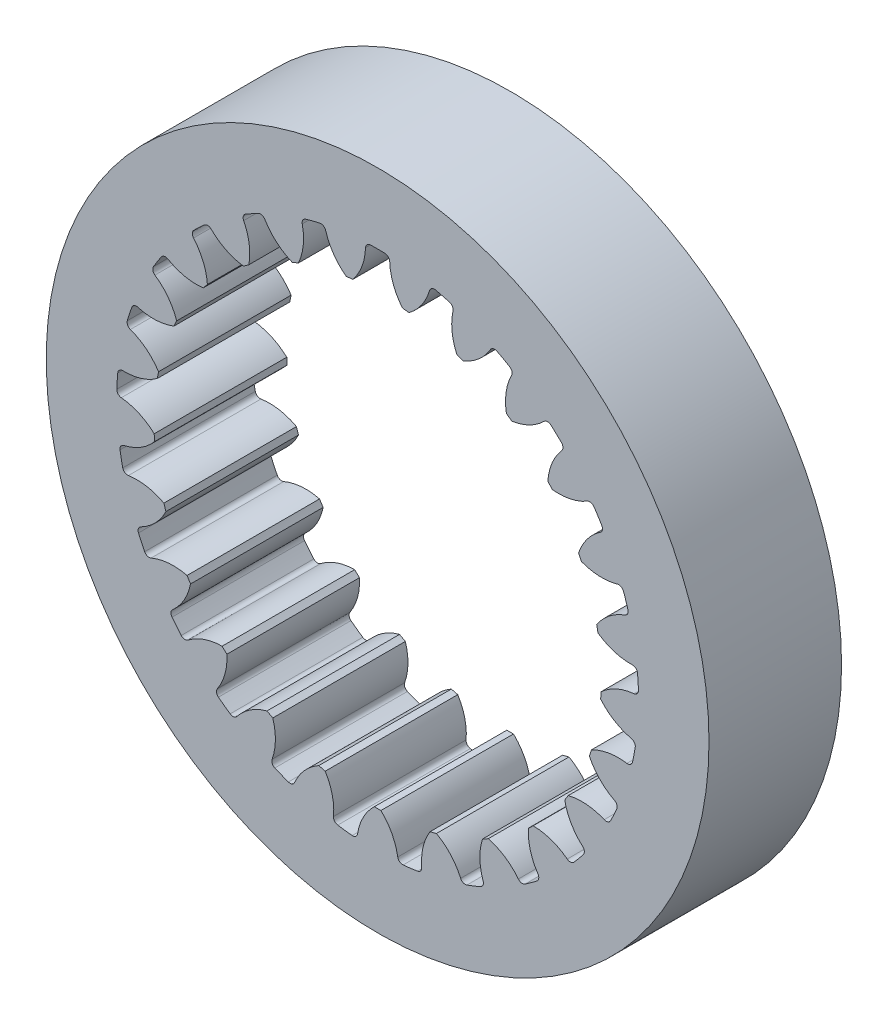
from build123d import *

# Parameters (mm, degrees)
SKETCH_1_R                       = 25
EXTRUDE_1_DEPTH                  = 10
CUT_EXTRUDE_2_DEPTH              = 37.742346142
FILLET_1_R                       = 0.375
PATTERN_CIRCULAR_1_COUNT         = 25
FILLET_1_OF_PATTERN_CIRCULAR_1_R = 0.375


with BuildPart() as part:
    # Эскиз1 → Бобышка-Вытянуть1 (new body)
    with BuildSketch(Plane.XY):
        Circle(SKETCH_1_R)
    extrude(amount=EXTRUDE_1_DEPTH)

    # Эскиз2 → Вырез-Вытянуть2 (cut, symmetric)
    with BuildSketch(Plane.XY):
        with BuildLine():
            ThreePointArc((1.867238125, 16.771375817), (1.124083924, 18.131023222), (0.914364942, 19.666255185))
            ThreePointArc((0.914364942, 19.666255185), (0, 19.6875), (-0.914364942, 19.666255185))
            ThreePointArc((-0.914364942, 19.666255185), (-1.124083924, 18.131023222), (-1.867238125, 16.771375817))
            ThreePointArc((-1.867238125, 16.771375817), (0, -16.875), (1.867238125, 16.771375817))
        make_face()
    cut_extrude_2 = extrude(amount=CUT_EXTRUDE_2_DEPTH, both=True, mode=Mode.SUBTRACT)

    # Скругление1
    fillet_1_edges = [part.edges().sort_by_distance(p)[0] for p in [
        (-0.914364942, 19.666255185, 5),
        (0.914364942, 19.666255185, 5),
    ]]
    fillet(fillet_1_edges, radius=FILLET_1_R)

    # Круговой массив1: Вырез-Вытянуть2 ×25 about axis
    pattern_circular_1_axis = Axis((0, 0, 0), (0, 0, 1))
    for i in range(1, PATTERN_CIRCULAR_1_COUNT):
        add(cut_extrude_2.rotate(pattern_circular_1_axis, i * 360 / PATTERN_CIRCULAR_1_COUNT), mode=Mode.SUBTRACT)

    # Скругление1 of Круговой массив1
    fillet_1_of_pattern_circular_1_edges = [part.edges().sort_by_distance(p)[0] for p in [
        (-5.776437269, 18.8210103, 5),
        (-4.005160297, 19.275796929, 5),
        (-10.275554798, 16.79317212, 5),
        (-8.673026584, 17.674169461, 5),
        (-14.129021428, 13.710157174, 5),
        (-12.795934714, 14.962008924, 5),
        (-17.094709679, 9.76568263, 5),
        (-16.114827206, 11.30973034, 5),
        (-18.986274451, 5.207594331, 5),
        (-18.421165839, 6.946819805, 5),
        (-19.684861773, 0.322293728, 5),
        (-19.570034873, 2.147415032, 5),
        (-19.146576833, -4.583257775, 5),
        (-19.489246643, -2.786919724, 5),
        (-17.405242055, -9.200826336, 5),
        (-18.18387737, -7.546142065, 5),
        (-14.570271906, -13.24027314, 5),
        (-15.735948206, -11.831212547, 5),
        (-10.819797988, -16.447784889, 5),
        (-12.299271543, -15.372884432, 5),
        (-6.38947637, -18.621821822, 5),
        (-8.089786416, -17.948621451, 5),
        (-1.557680453, -19.625781204, 5),
        (-3.371990256, -19.396580574, 5),
        (3.371990256, -19.396580574, 5),
        (1.557680453, -19.625781204, 5),
        (8.089786416, -17.948621451, 5),
        (6.38947637, -18.621821822, 5),
        (12.299271543, -15.372884432, 5),
        (10.819797988, -16.447784889, 5),
        (15.735948206, -11.831212547, 5),
        (14.570271906, -13.24027314, 5),
        (18.18387737, -7.546142065, 5),
        (17.405242055, -9.200826336, 5),
        (19.489246643, -2.786919724, 5),
        (19.146576833, -4.583257775, 5),
        (19.570034873, 2.147415032, 5),
        (19.684861773, 0.322293728, 5),
        (18.421165839, 6.946819805, 5),
        (18.986274451, 5.207594331, 5),
        (16.114827206, 11.30973034, 5),
        (17.094709679, 9.76568263, 5),
        (12.795934714, 14.962008924, 5),
        (14.129021428, 13.710157174, 5),
        (8.673026584, 17.674169461, 5),
        (10.275554798, 16.79317212, 5),
        (4.005160297, 19.275796929, 5),
        (5.776437269, 18.8210103, 5),
    ]]
    fillet(fillet_1_of_pattern_circular_1_edges, radius=FILLET_1_OF_PATTERN_CIRCULAR_1_R)


solid = part.part
